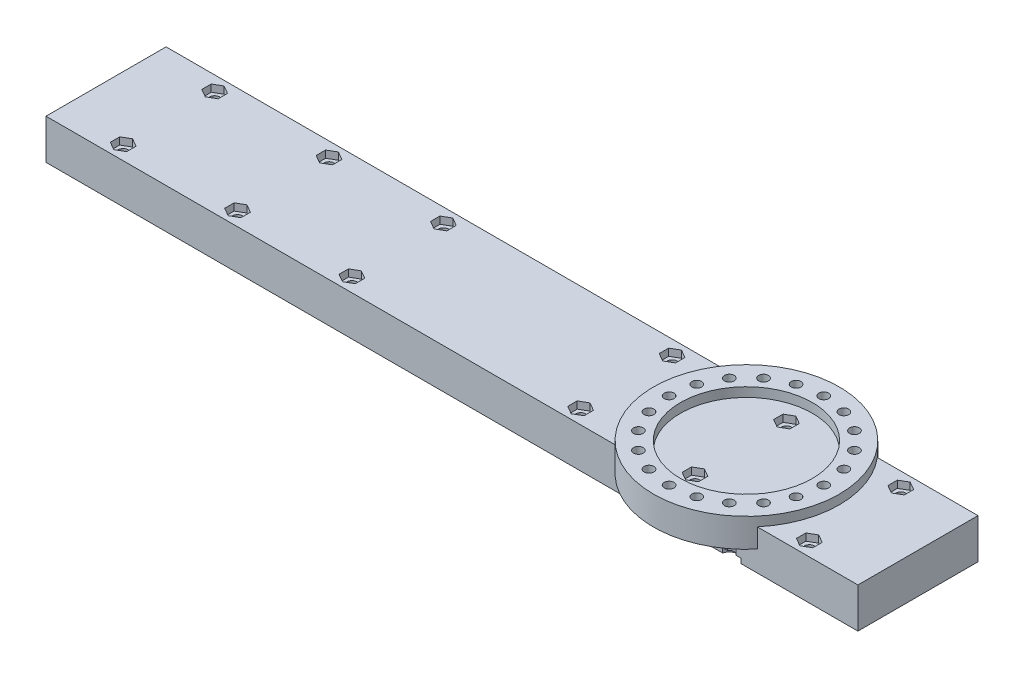
from build123d import *

# Parameters (mm, degrees)
SKETCH1_R                       = 32.5
BOSS_EXTRUDE1_DEPTH             = 10
SKETCH2_R                       = 23.05
CUT_EXTRUDE1_DEPTH              = 3.25
BOSS_EXTRUDE2_DEPTH             = 7.25
BOSS_EXTRUDE2_DEPTH_BACK        = 6.75
CBORE_FOR_M3_SBHCS1_D           = 3.4
CBORE_FOR_M3_SBHCS1_CBORE_D     = 6.7
CBORE_FOR_M3_SBHCS1_CBORE_DEPTH = 1.65
CUT_EXTRUDE3_DEPTH              = 2.5
SKETCH7_R                       = 1.7
CUT_EXTRUDE4_DEPTH              = 228.001789641


with BuildPart() as part:
    # Sketch1 → Boss-Extrude1 (new body)
    with BuildSketch(Plane(origin=(0, 0, 0), x_dir=(1, 0, 0), z_dir=(0, 1, 0))):
        Circle(SKETCH1_R)
    extrude(amount=BOSS_EXTRUDE1_DEPTH)

    # Sketch2 → Cut-Extrude1 (cut)
    with BuildSketch(Plane(origin=(0, 10, 0), x_dir=(1, 0, 0), z_dir=(0, 1, 0))):
        Circle(SKETCH2_R)
    extrude(amount=-CUT_EXTRUDE1_DEPTH, mode=Mode.SUBTRACT)

    # Sketch3 → Boss-Extrude2 (add, two sides: drawn at the far end of the back side and taken through both)
    with BuildSketch(Plane.XZ.offset(-BOSS_EXTRUDE2_DEPTH_BACK)):
        Polygon((-224, 21), (-3.439528279, 21), (60, 21), (60, -21), (-24.489517729, -21), (-224, -21), align=None)
    extrude(amount=BOSS_EXTRUDE2_DEPTH + BOSS_EXTRUDE2_DEPTH_BACK)

    # CBORE for M3 SBHCS1 (through all)
    with Locations(Plane.XZ.offset(7.25)):
        with Locations((0, 27.05), (8.358909698, 25.726078766), (15.899591075, 21.883909698), (21.883909698, 15.899591075), (25.726078766, 8.358909698), (27.05, 0), (25.726078766, -8.358909698), (21.883909698, -15.899591075), (15.899591075, -21.883909698), (8.358909698, -25.726078766), (0, -27.05), (-8.358909698, -25.726078766), (-15.899591075, -21.883909698), (-21.883909698, -15.899591075), (-25.726078766, -8.358909698), (-27.05, 0), (-25.726078766, 8.358909698), (-21.883909698, 15.899591075), (-15.899591075, 21.883909698), (-8.358909698, 25.726078766)):
            CounterBoreHole(CBORE_FOR_M3_SBHCS1_D / 2, CBORE_FOR_M3_SBHCS1_CBORE_D / 2, CBORE_FOR_M3_SBHCS1_CBORE_DEPTH)

    # Sketch6 → Cut-Extrude3 (cut)
    with BuildSketch(Plane(origin=(0, 6.75, 0), x_dir=(1, 0, 0), z_dir=(0, 1, 0))):
        Polygon((-202, 19.290896534), (-204.85, 17.645448267), (-204.85, 14.354551733), (-202, 12.709103466), (-199.15, 14.354551733), (-199.15, 17.645448267), align=None)
        Polygon((-202, -12.709103466), (-204.85, -14.354551733), (-204.85, -17.645448267), (-202, -19.290896534), (-199.15, -17.645448267), (-199.15, -14.354551733), align=None)
        Polygon((-162, -12.709103466), (-164.85, -14.354551733), (-164.85, -17.645448267), (-162, -19.290896534), (-159.15, -17.645448267), (-159.15, -14.354551733), align=None)
        Polygon((-122, -12.709103466), (-124.85, -14.354551733), (-124.85, -17.645448267), (-122, -19.290896534), (-119.15, -17.645448267), (-119.15, -14.354551733), align=None)
        Polygon((-162, 19.290896534), (-164.85, 17.645448267), (-164.85, 14.354551733), (-162, 12.709103466), (-159.15, 14.354551733), (-159.15, 17.645448267), align=None)
        Polygon((-122, 19.290896534), (-124.85, 17.645448267), (-124.85, 14.354551733), (-122, 12.709103466), (-119.15, 14.354551733), (-119.15, 17.645448267), align=None)
        Polygon((-42, 19.290896534), (-44.85, 17.645448267), (-44.85, 14.354551733), (-42, 12.709103466), (-39.15, 14.354551733), (-39.15, 17.645448267), align=None)
        Polygon((-2, 19.290896534), (-4.85, 17.645448267), (-4.85, 14.354551733), (-2, 12.709103466), (0.85, 14.354551733), (0.85, 17.645448267), align=None)
        Polygon((38, 19.290896534), (35.15, 17.645448267), (35.15, 14.354551733), (38, 12.709103466), (40.85, 14.354551733), (40.85, 17.645448267), align=None)
        Polygon((38, -12.709103466), (35.15, -14.354551733), (35.15, -17.645448267), (38, -19.290896534), (40.85, -17.645448267), (40.85, -14.354551733), align=None)
        Polygon((-2, -12.709103466), (-4.85, -14.354551733), (-4.85, -17.645448267), (-2, -19.290896534), (0.85, -17.645448267), (0.85, -14.354551733), align=None)
        Polygon((-42, -12.709103466), (-44.85, -14.354551733), (-44.85, -17.645448267), (-42, -19.290896534), (-39.15, -17.645448267), (-39.15, -14.354551733), align=None)
    extrude(amount=-CUT_EXTRUDE3_DEPTH, mode=Mode.SUBTRACT)

    # Sketch7 → Cut-Extrude4 (cut, through all)
    with BuildSketch(Plane.XZ.offset(7.25)):
        with Locations((-202, 16)):
            Circle(SKETCH7_R)
        with Locations((-202, -16)):
            Circle(SKETCH7_R)
        with Locations((-162, -16)):
            Circle(SKETCH7_R)
        with Locations((-162, 16)):
            Circle(SKETCH7_R)
        with Locations((-122, 16)):
            Circle(SKETCH7_R)
        with Locations((-122, -16)):
            Circle(SKETCH7_R)
        with Locations((-42, 16)):
            Circle(SKETCH7_R)
        with Locations((-2, 16)):
            Circle(SKETCH7_R)
        with Locations((38, 16)):
            Circle(SKETCH7_R)
        with Locations((38, -16)):
            Circle(SKETCH7_R)
        with Locations((-2, -16)):
            Circle(SKETCH7_R)
        with Locations((-42, -16)):
            Circle(SKETCH7_R)
    extrude(amount=-CUT_EXTRUDE4_DEPTH, mode=Mode.SUBTRACT)


solid = part.part
